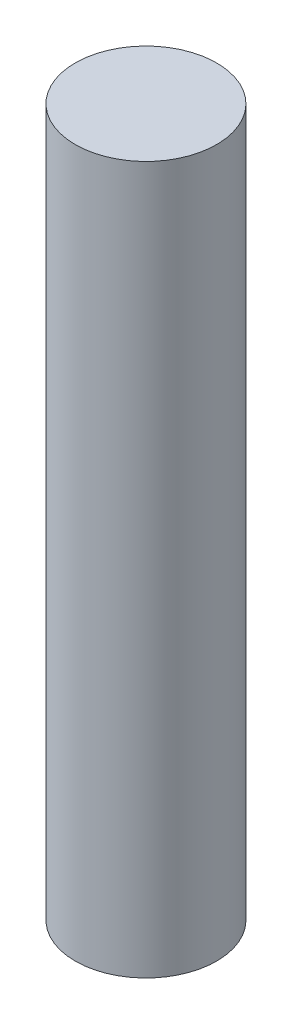
from build123d import *

# Parameters (mm, degrees)
SKETCH1_R           = 1.5
BOSS_EXTRUDE1_DEPTH = 7.5


with BuildPart() as part:
    # Sketch1 → Boss-Extrude1 (new, symmetric)
    with BuildSketch(Plane(origin=(0, 0, 0), x_dir=(1, 0, 0), z_dir=(0, 1, 0))):
        with Locations(Location((0, -10.5, 0), (0, 0, 270))):
            Circle(SKETCH1_R)
    extrude(amount=BOSS_EXTRUDE1_DEPTH, both=True)


solid = part.part
